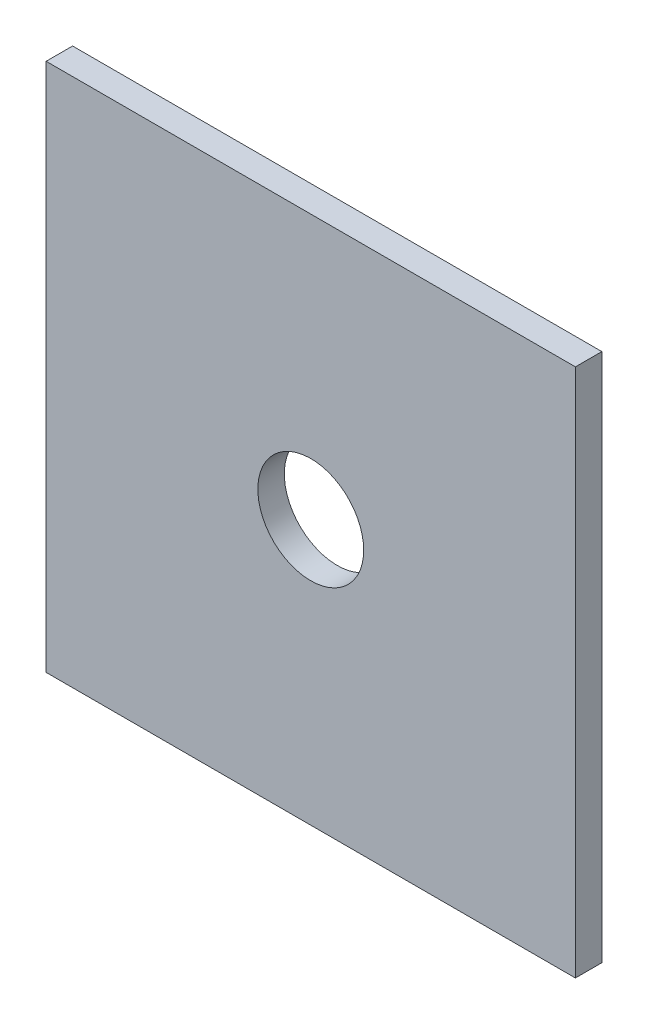
from build123d import *

# Parameters (mm, degrees)
SKETCH1_W           = 40
SKETCH1_H           = 40
BOSS_EXTRUDE1_DEPTH = 1
SKETCH2_R           = 4
CUT_EXTRUDE1_DEPTH  = 29.354893758


with BuildPart() as part:
    # Sketch1 → Boss-Extrude1 (new, symmetric)
    with BuildSketch(Plane.XY):
        Rectangle(SKETCH1_W, SKETCH1_H)
    extrude(amount=BOSS_EXTRUDE1_DEPTH, both=True)

    # Sketch2 → Cut-Extrude1 (cut, through all)
    with BuildSketch(Plane.XY.offset(1)):
        Circle(SKETCH2_R)
    extrude(amount=-CUT_EXTRUDE1_DEPTH, mode=Mode.SUBTRACT)


solid = part.part
